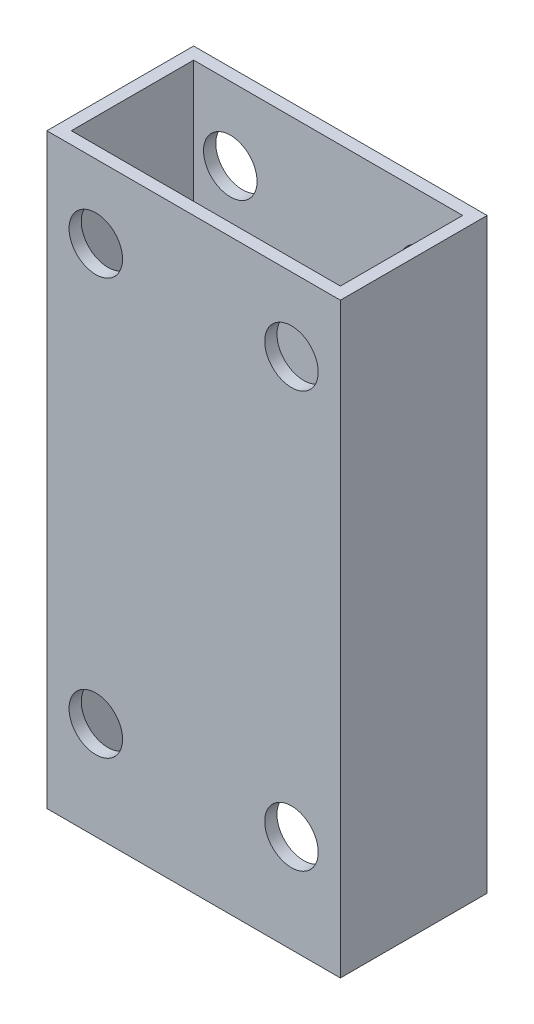
from build123d import *

# Parameters (mm, degrees)
SKETCH1_W               = 76.2
SKETCH1_H               = 38.1
EXTRUDE1_DEPTH          = 76.2
SKETCH2_W               = 69.85
SKETCH2_H               = 31.75
EXTRUDE2_DEPTH          = 159.241184589
F_1_2_CLEARANCE_HOLE1_D = 13.89126


with BuildPart() as part:
    # Sketch1 → Extrude1 (new, symmetric)
    with BuildSketch(Plane(origin=(0, 0, 0), x_dir=(1, 0, 0), z_dir=(0, 1, 0))):
        Rectangle(SKETCH1_W, SKETCH1_H)
    extrude(amount=EXTRUDE1_DEPTH, both=True)

    # Sketch2 → Extrude2 (cut, through all)
    with BuildSketch(Plane(origin=(0, 76.2, 0), x_dir=(1, 0, 0), z_dir=(0, 1, 0))):
        Rectangle(SKETCH2_W, SKETCH2_H)
    extrude(amount=-EXTRUDE2_DEPTH, mode=Mode.SUBTRACT)

    # 1/2 Clearance Hole1 (through all)
    with Locations(Plane.XY.offset(19.05)):
        with Locations((25.4, 57.15), (-25.4, 57.15), (-25.4, -50.8), (25.4, -50.8)):
            Hole(F_1_2_CLEARANCE_HOLE1_D / 2)


solid = part.part
